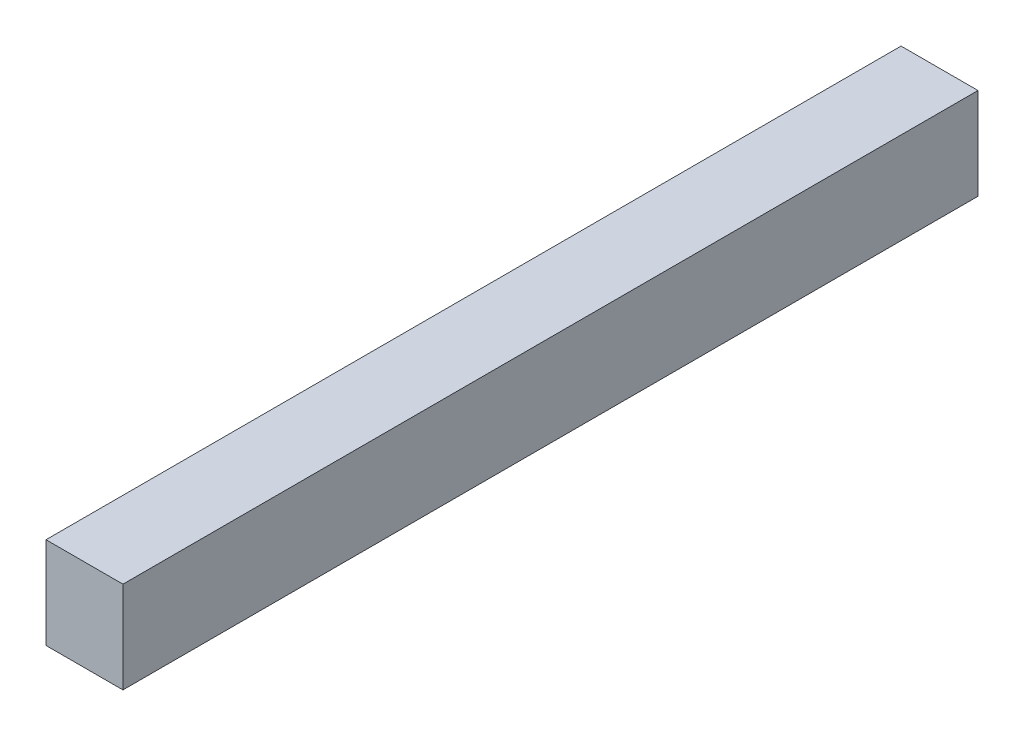
from build123d import *

# Parameters (mm, degrees)
ESQUISSE1_W        = 63
ESQUISSE1_H        = 75
BOSS_EXTRU_1_DEPTH = 700


with BuildPart() as part:
    # Esquisse1 → Boss.-Extru.1 (new body)
    with BuildSketch(Plane.XY):
        with Locations((31.5, 37.5)):
            Rectangle(ESQUISSE1_W, ESQUISSE1_H)
    extrude(amount=BOSS_EXTRU_1_DEPTH)


solid = part.part
